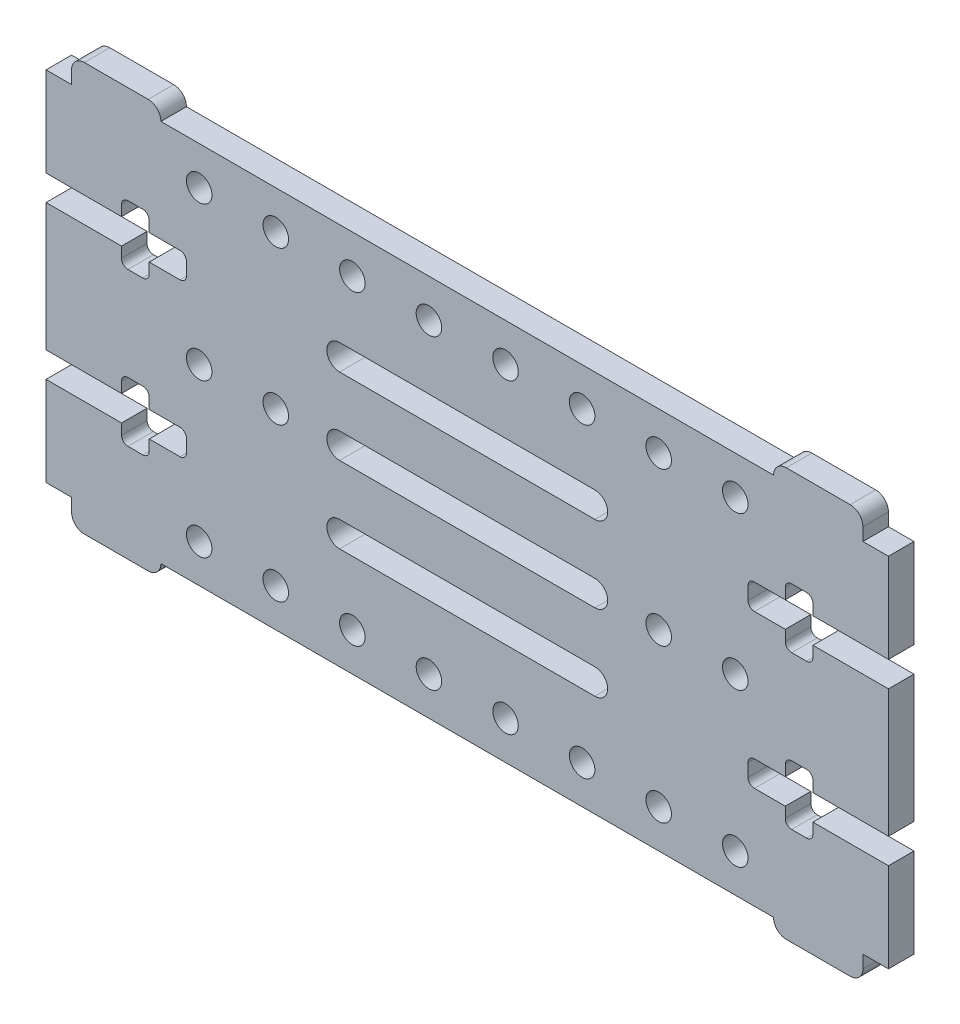
from build123d import *

# Parameters (mm, degrees)
MODEL_R                 = 1.5
SALIENTE_EXTRUIR1_DEPTH = 3


with BuildPart() as part:
    # Model → Saliente-Extruir1 (new body)
    with BuildSketch(Plane.XY):
        with BuildLine():
            Line((-1383.727545355, 378.908179756), (-1386.727545355, 378.908179756))
            Line((-1386.727545355, 378.908179756), (-1386.727545355, 380.408179756))
            ThreePointArc((-1386.727545355, 380.408179756), (-1387.166885184, 381.468839928), (-1388.227545355, 381.908179756))
            Line((-1388.227545355, 381.908179756), (-1395.72785056, 381.908179756))
            ThreePointArc((-1395.72785056, 381.908179756), (-1396.788510732, 381.468839928), (-1397.22785056, 380.408179756))
            Line((-1397.22785056, 380.408179756), (-1469.22785056, 380.408179756))
            ThreePointArc((-1469.22785056, 380.408179756), (-1469.667190388, 381.468839928), (-1470.72785056, 381.908179756))
            Line((-1470.72785056, 381.908179756), (-1478.227545355, 381.908179756))
            ThreePointArc((-1478.227545355, 381.908179756), (-1479.288205527, 381.468839928), (-1479.727545355, 380.408179756))
            Line((-1479.727545355, 380.408179756), (-1479.727545355, 378.908179756))
            Line((-1479.727545355, 378.908179756), (-1482.727545355, 378.908179756))
            Line((-1482.727545355, 378.908179756), (-1482.727545355, 368.408179756))
            Line((-1482.727545355, 368.408179756), (-1473.852545355, 368.408179756))
            Line((-1473.852545355, 368.408179756), (-1473.852545355, 369.658179757))
            ThreePointArc((-1473.852545355, 369.658179757), (-1473.632875441, 370.188509842), (-1473.102545355, 370.408179756))
            Line((-1473.102545355, 370.408179756), (-1471.352545355, 370.408179756))
            ThreePointArc((-1471.352545355, 370.408179756), (-1470.82221527, 370.188509842), (-1470.602545355, 369.658179757))
            Line((-1470.602545355, 369.658179757), (-1470.602545355, 368.408179756))
            Line((-1470.602545355, 368.408179756), (-1466.977545355, 368.408179756))
            ThreePointArc((-1466.977545355, 368.408179756), (-1466.44721527, 368.188509842), (-1466.227545355, 367.658179756))
            Line((-1466.227545355, 367.658179756), (-1466.227545355, 366.158179756))
            ThreePointArc((-1466.227545355, 366.158179756), (-1466.44721527, 365.627849671), (-1466.977545355, 365.408179756))
            Line((-1466.977545355, 365.408179756), (-1470.602545355, 365.408179756))
            Line((-1470.602545355, 365.408179756), (-1470.602545355, 364.158179756))
            ThreePointArc((-1470.602545355, 364.158179756), (-1470.82221527, 363.627849671), (-1471.352545355, 363.408179756))
            Line((-1471.352545355, 363.408179756), (-1473.102545355, 363.408179756))
            ThreePointArc((-1473.102545355, 363.408179756), (-1473.632875441, 363.627849671), (-1473.852545355, 364.158179756))
            Line((-1473.852545355, 364.158179756), (-1473.852545355, 365.408179756))
            Line((-1473.852545355, 365.408179756), (-1482.727545355, 365.408179756))
            Line((-1482.727545355, 365.408179756), (-1482.727545355, 350.408179756))
            Line((-1482.727545355, 350.408179756), (-1473.852545355, 350.408179756))
            Line((-1473.852545355, 350.408179756), (-1473.852545355, 351.658179756))
            ThreePointArc((-1473.852545355, 351.658179756), (-1473.632875441, 352.188509842), (-1473.102545355, 352.408179756))
            Line((-1473.102545355, 352.408179756), (-1471.352545355, 352.408179756))
            ThreePointArc((-1471.352545355, 352.408179756), (-1470.82221527, 352.188509842), (-1470.602545355, 351.658179756))
            Line((-1470.602545355, 351.658179756), (-1470.602545355, 350.408179756))
            Line((-1470.602545355, 350.408179756), (-1466.977545355, 350.408179756))
            ThreePointArc((-1466.977545355, 350.408179756), (-1466.44721527, 350.188509842), (-1466.227545355, 349.658179756))
            Line((-1466.227545355, 349.658179756), (-1466.227545355, 348.158179756))
            ThreePointArc((-1466.227545355, 348.158179756), (-1466.44721527, 347.627849671), (-1466.977545355, 347.408179756))
            Line((-1466.977545355, 347.408179756), (-1470.602545355, 347.408179756))
            Line((-1470.602545355, 347.408179756), (-1470.602545355, 346.158179756))
            ThreePointArc((-1470.602545355, 346.158179756), (-1470.82221527, 345.627849671), (-1471.352545355, 345.408179756))
            Line((-1471.352545355, 345.408179756), (-1473.102545355, 345.408179756))
            ThreePointArc((-1473.102545355, 345.408179756), (-1473.632875441, 345.627849671), (-1473.852545355, 346.158179756))
            Line((-1473.852545355, 346.158179756), (-1473.852545355, 347.408179756))
            Line((-1473.852545355, 347.408179756), (-1482.727545355, 347.408179756))
            Line((-1482.727545355, 347.408179756), (-1482.727545355, 336.908179756))
            Line((-1482.727545355, 336.908179756), (-1479.727545355, 336.908179756))
            Line((-1479.727545355, 336.908179756), (-1479.727545355, 335.408179756))
            ThreePointArc((-1479.727545355, 335.408179756), (-1479.288205527, 334.347519585), (-1478.227545355, 333.908179756))
            Line((-1478.227545355, 333.908179756), (-1470.72785056, 333.908179756))
            ThreePointArc((-1470.72785056, 333.908179756), (-1469.667190388, 334.347519585), (-1469.22785056, 335.408179756))
            Line((-1469.22785056, 335.408179756), (-1397.22785056, 335.408179756))
            ThreePointArc((-1397.22785056, 335.408179756), (-1396.788510732, 334.347519585), (-1395.72785056, 333.908179756))
            Line((-1395.72785056, 333.908179756), (-1388.227545355, 333.908179756))
            ThreePointArc((-1388.227545355, 333.908179756), (-1387.166885184, 334.347519585), (-1386.727545355, 335.408179756))
            Line((-1386.727545355, 335.408179756), (-1386.727545355, 336.908179756))
            Line((-1386.727545355, 336.908179756), (-1383.727545355, 336.908179756))
            Line((-1383.727545355, 336.908179756), (-1383.727545355, 347.408179756))
            Line((-1383.727545355, 347.408179756), (-1392.602545355, 347.408179756))
            Line((-1392.602545355, 347.408179756), (-1392.602545355, 346.158179756))
            ThreePointArc((-1392.602545355, 346.158179756), (-1392.82221527, 345.627849671), (-1393.352545355, 345.408179756))
            Line((-1393.352545355, 345.408179756), (-1395.102545355, 345.408179756))
            ThreePointArc((-1395.102545355, 345.408179756), (-1395.632875441, 345.627849671), (-1395.852545355, 346.158179756))
            Line((-1395.852545355, 346.158179756), (-1395.852545355, 347.408179756))
            Line((-1395.852545355, 347.408179756), (-1399.477545355, 347.408179756))
            ThreePointArc((-1399.477545355, 347.408179756), (-1400.007875441, 347.627849671), (-1400.227545355, 348.158179756))
            Line((-1400.227545355, 348.158179756), (-1400.227545355, 349.658179756))
            ThreePointArc((-1400.227545355, 349.658179756), (-1400.007875441, 350.188509842), (-1399.477545355, 350.408179756))
            Line((-1399.477545355, 350.408179756), (-1395.852545355, 350.408179756))
            Line((-1395.852545355, 350.408179756), (-1395.852545355, 351.658179756))
            ThreePointArc((-1395.852545355, 351.658179756), (-1395.632875441, 352.188509842), (-1395.102545355, 352.408179756))
            Line((-1395.102545355, 352.408179756), (-1393.352545355, 352.408179756))
            ThreePointArc((-1393.352545355, 352.408179756), (-1392.82221527, 352.188509842), (-1392.602545355, 351.658179756))
            Line((-1392.602545355, 351.658179756), (-1392.602545355, 350.408179756))
            Line((-1392.602545355, 350.408179756), (-1383.727545355, 350.408179756))
            Line((-1383.727545355, 350.408179756), (-1383.727545355, 365.408179756))
            Line((-1383.727545355, 365.408179756), (-1392.602545355, 365.408179756))
            Line((-1392.602545355, 365.408179756), (-1392.602545355, 364.158179756))
            ThreePointArc((-1392.602545355, 364.158179756), (-1392.82221527, 363.627849671), (-1393.352545355, 363.408179756))
            Line((-1393.352545355, 363.408179756), (-1395.102545355, 363.408179756))
            ThreePointArc((-1395.102545355, 363.408179756), (-1395.632875441, 363.627849671), (-1395.852545355, 364.158179756))
            Line((-1395.852545355, 364.158179756), (-1395.852545355, 365.408179756))
            Line((-1395.852545355, 365.408179756), (-1399.477545355, 365.408179756))
            ThreePointArc((-1399.477545355, 365.408179756), (-1400.007875441, 365.627849671), (-1400.227545355, 366.158179756))
            Line((-1400.227545355, 366.158179756), (-1400.227545355, 367.658179756))
            ThreePointArc((-1400.227545355, 367.658179756), (-1400.007875441, 368.188509842), (-1399.477545355, 368.408179756))
            Line((-1399.477545355, 368.408179756), (-1395.852545355, 368.408179756))
            Line((-1395.852545355, 368.408179756), (-1395.852545355, 369.658179757))
            ThreePointArc((-1395.852545355, 369.658179757), (-1395.632875441, 370.188509842), (-1395.102545355, 370.408179756))
            Line((-1395.102545355, 370.408179756), (-1393.352545355, 370.408179756))
            ThreePointArc((-1393.352545355, 370.408179756), (-1392.82221527, 370.188509842), (-1392.602545355, 369.658179757))
            Line((-1392.602545355, 369.658179757), (-1392.602545355, 368.408179756))
            Line((-1392.602545355, 368.408179756), (-1383.727545355, 368.408179756))
            Line((-1383.727545355, 368.408179756), (-1383.727545355, 378.908179756))
        make_face()
        with Locations((-1401.728155765, 357.908179756)):
            Circle(MODEL_R, mode=Mode.SUBTRACT)
        with Locations((-1464.728155765, 357.908179756)):
            Circle(MODEL_R, mode=Mode.SUBTRACT)
        with Locations((-1455.728155765, 357.908179756)):
            Circle(MODEL_R, mode=Mode.SUBTRACT)
        with Locations((-1410.728155765, 357.908179756)):
            Circle(MODEL_R, mode=Mode.SUBTRACT)
        with Locations((-1464.728155765, 375.908179756)):
            Circle(MODEL_R, mode=Mode.SUBTRACT)
        with Locations((-1455.728155765, 375.908179756)):
            Circle(MODEL_R, mode=Mode.SUBTRACT)
        with Locations((-1446.728155765, 375.908179756)):
            Circle(MODEL_R, mode=Mode.SUBTRACT)
        with Locations((-1437.728155765, 375.908179756)):
            Circle(MODEL_R, mode=Mode.SUBTRACT)
        with Locations((-1428.728155765, 375.908179756)):
            Circle(MODEL_R, mode=Mode.SUBTRACT)
        with Locations((-1419.728155765, 375.908179756)):
            Circle(MODEL_R, mode=Mode.SUBTRACT)
        with Locations((-1410.728155765, 375.908179756)):
            Circle(MODEL_R, mode=Mode.SUBTRACT)
        with Locations((-1401.728155765, 375.908179756)):
            Circle(MODEL_R, mode=Mode.SUBTRACT)
        with Locations((-1464.728155765, 339.908179757)):
            Circle(MODEL_R, mode=Mode.SUBTRACT)
        with Locations((-1455.728155765, 339.908179757)):
            Circle(MODEL_R, mode=Mode.SUBTRACT)
        with Locations((-1446.728155765, 339.908179757)):
            Circle(MODEL_R, mode=Mode.SUBTRACT)
        with Locations((-1437.728155765, 339.908179757)):
            Circle(MODEL_R, mode=Mode.SUBTRACT)
        with Locations((-1428.728155765, 339.908179757)):
            Circle(MODEL_R, mode=Mode.SUBTRACT)
        with Locations((-1419.728155765, 339.908179757)):
            Circle(MODEL_R, mode=Mode.SUBTRACT)
        with Locations((-1410.728155765, 339.908179757)):
            Circle(MODEL_R, mode=Mode.SUBTRACT)
        with Locations((-1401.728155765, 339.908179757)):
            Circle(MODEL_R, mode=Mode.SUBTRACT)
        with BuildLine():
            Line((-1448.227545355, 350.408179756), (-1418.227545355, 350.408179756))
            ThreePointArc((-1418.227545355, 350.408179756), (-1416.727545355, 348.908179756), (-1418.227545355, 347.408179756))
            Line((-1418.227545355, 347.408179756), (-1448.227545355, 347.408179756))
            ThreePointArc((-1448.227545355, 347.408179756), (-1449.727545355, 348.908179756), (-1448.227545355, 350.408179756))
        make_face(mode=Mode.SUBTRACT)
        with BuildLine():
            Line((-1448.227545355, 359.408179756), (-1418.227545355, 359.408179756))
            ThreePointArc((-1418.227545355, 359.408179756), (-1416.727545355, 357.908179756), (-1418.227545355, 356.408179756))
            Line((-1418.227545355, 356.408179756), (-1448.227545355, 356.408179756))
            ThreePointArc((-1448.227545355, 356.408179756), (-1449.727545355, 357.908179756), (-1448.227545355, 359.408179756))
        make_face(mode=Mode.SUBTRACT)
        with BuildLine():
            Line((-1448.227545355, 368.408179756), (-1418.227545355, 368.408179756))
            ThreePointArc((-1418.227545355, 368.408179756), (-1416.727545355, 366.908179756), (-1418.227545355, 365.408179756))
            Line((-1418.227545355, 365.408179756), (-1448.227545355, 365.408179756))
            ThreePointArc((-1448.227545355, 365.408179756), (-1449.727545355, 366.908179756), (-1448.227545355, 368.408179756))
        make_face(mode=Mode.SUBTRACT)
    extrude(amount=SALIENTE_EXTRUIR1_DEPTH)


solid = part.part
